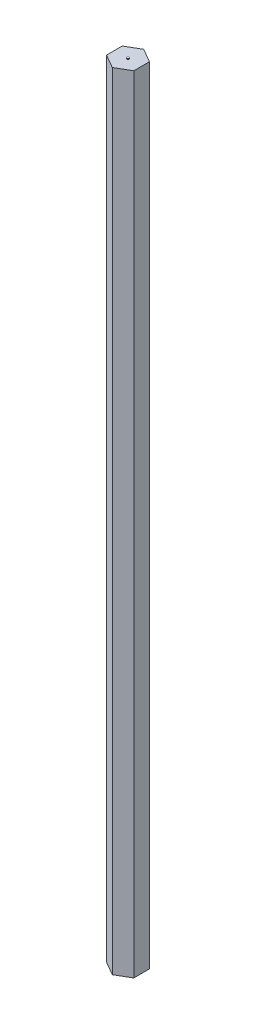
from build123d import *

# Parameters (mm, degrees)
BOSS_EXTRUDE1_DEPTH = 100000
SKETCH2_R           = 150
BOSS_EXTRUDE2_DEPTH = 100


with BuildPart() as part:
    # Sketch1 → Boss-Extrude1 (new body)
    with BuildSketch(Plane(origin=(0, 0, 0), x_dir=(1, 0, 0), z_dir=(0, 1, 0))):
        Polygon((0, -2000), (1732.050807569, -1000), (1732.050807569, 1000), (0, 2000), (-1732.050807569, 1000), (-1732.050807569, -1000), align=None)
    extrude(amount=BOSS_EXTRUDE1_DEPTH)

    # Sketch2 → Boss-Extrude2 (add)
    with BuildSketch(Plane(origin=(0, 100000, 0), x_dir=(1, 0, 0), z_dir=(0, 1, 0))):
        with Locations(Location((0, 0, 0), (0, 0, 270))):
            Circle(SKETCH2_R)
    extrude(amount=BOSS_EXTRUDE2_DEPTH)


solid = part.part
